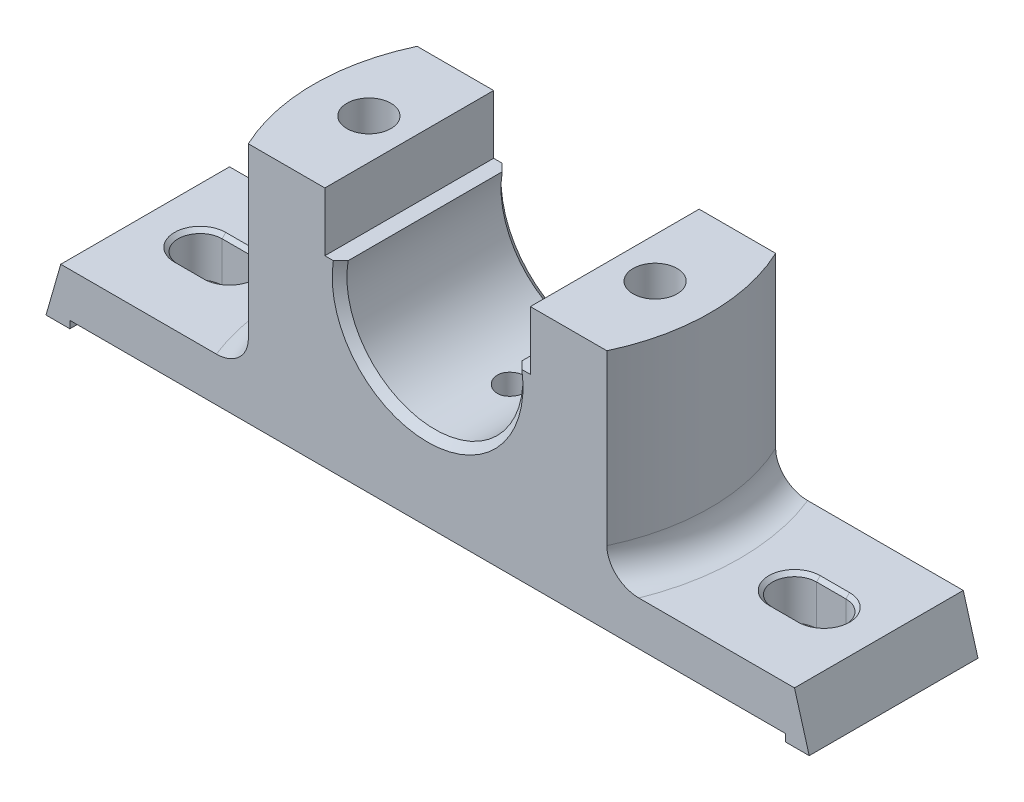
from build123d import *

# Parameters (mm, degrees)
BOSS_EXTRUDE1_DEPTH     = 23
CUT_EXTRUDE5_DEPTH      = 54
FILLET1_R               = 8
CHAMFER1_SIZE           = 2
CUT_EXTRUDE2_DEPTH      = 117.82893492196186
CUT_EXTRUDE2_DEPTH_BACK = 117.82893492196186
SKETCH4_W               = 195
SKETCH4_H               = 2
CUT_EXTRUDE6_DEPTH      = 120.41942905658195
SKETCH5_W               = 28.000000000000004
SKETCH5_H               = 30
SKETCH5_R               = 6.000000000000002
CUT_EXTRUDE3_DEPTH      = 10
SKETCH5_2_R             = 6.000000000000002
CUT_EXTRUDE7_DEPTH      = 126.30363138632497
CHAMFER2_SIZE           = 1
SKETCH9_R               = 4
CUT_EXTRUDE8_DEPTH      = 36


with BuildPart() as part:
    # Sketch1 → Boss-Extrude1 (new, symmetric)
    with BuildSketch(Plane.XY):
        with BuildLine():
            Line((-104, -48), (104, -48))
            Line((104, -48), (99.98556459937663, -34))
            Line((99.98556459937663, -34), (54.00000000000001, -34.00000000000001))
            Line((54.00000000000001, -34.00000000000001), (54.00000000000001, 20))
            Line((54.00000000000001, 20), (28.000000000000004, 20))
            Line((28.000000000000004, 20), (28, 4))
            Line((28, 4), (23.664319132398468, 4))
            ThreePointArc((23.664319132398468, 4), (1.47e-15, -24.000000000000004), (-23.664319132398465, 4))
            Line((-23.664319132398465, 4), (-28, 4))
            Line((-28, 4), (-28, 20))
            Line((-28, 20), (-54.00000000000001, 20))
            Line((-54.00000000000001, 20), (-54.00000000000001, -34.00000000000001))
            Line((-54.00000000000001, -34.00000000000001), (-99.98556459937662, -33.99999999999999))
            Line((-99.98556459937662, -33.99999999999999), (-104, -48))
        make_face()
    extrude(amount=BOSS_EXTRUDE1_DEPTH, both=True)

    # Sketch7 → Cut-Extrude5 (cut)
    with BuildSketch(Plane(origin=(0, 20, 0), x_dir=(1, 2.9e-16, 0), z_dir=(-2.9e-16, 1, 0))):
        with BuildLine():
            Line((-54.00000000000001, 23), (-54.00000000000001, 4.0501e-13))
            ThreePointArc((-54.000000000000014, 4.0856e-13), (-52.69855043578576, 11.784005344828431), (-48.856934001224445, 23))
            Line((-48.85693400122444, 23), (-54.00000000000001, 23))
        make_face()
        with BuildLine():
            Line((-54.00000000000001, 4.0501e-13), (-54.00000000000001, -23))
            Line((-54.00000000000001, -23), (-48.85693400122444, -23))
            ThreePointArc((-48.856934001224445, -23.000000000000004), (-52.69855043578586, -11.784005344828039), (-54.000000000000014, 4.0856e-13))
        make_face()
        with BuildLine():
            ThreePointArc((48.85693400122443, 23.000000000000004), (52.69855043578579, 11.784005344828252), (54, 3.286e-14))
            Line((54.00000000000001, 3.553e-14), (54.00000000000001, 23))
            Line((54.00000000000001, 23), (48.856934001224424, 23))
        make_face()
        with BuildLine():
            Line((48.856934001224424, -23), (54.00000000000001, -23))
            Line((54.00000000000001, -23), (54.00000000000001, 3.553e-14))
            ThreePointArc((54, 3.286e-14), (52.698550435785805, -11.784005344828213), (48.85693400122443, -23))
        make_face()
    extrude(amount=-CUT_EXTRUDE5_DEPTH, mode=Mode.SUBTRACT)

    # Fillet1
    fillet1_edges = [part.edges().sort_by_distance(p)[0] for p in [
        (-54.000000000000014, -34.000000000000014, -4.4e-16),
        (54.00000000000001, -33.999999999999986, 4.44e-15),
    ]]
    fillet(fillet1_edges, radius=FILLET1_R)

    # Chamfer1
    chamfer1_edges = [part.edges().sort_by_distance(p)[0] for p in [
        (-4.44e-15, -24.000000000000007, -23),
        (-4.44e-15, -24.000000000000007, 23),
    ]]
    chamfer(chamfer1_edges, length=CHAMFER1_SIZE)

    # Sketch4 → Cut-Extrude2 (cut, two sides: drawn at the far end of the back side and taken through both)
    with BuildSketch(Plane.XY.offset(-CUT_EXTRUDE2_DEPTH_BACK)):
        with Locations((0, -47)):
            Rectangle(SKETCH4_W, SKETCH4_H)
    extrude(amount=CUT_EXTRUDE2_DEPTH + CUT_EXTRUDE2_DEPTH_BACK, mode=Mode.SUBTRACT)

    # Sketch8 → Cut-Extrude6 (cut, through all)
    with BuildSketch(Plane(origin=(-1.026e-14, -34.00000000000002, 0), x_dir=(1, -3e-16, 0), z_dir=(3e-16, 1, 0))):
        with BuildLine():
            Line((-85, 6), (-77, 6))
            ThreePointArc((-77, 6), (-71, 0), (-77, -6))
            Line((-77, -6), (-85, -6))
            ThreePointArc((-85, -6), (-91, 7.3e-16), (-85, 6))
        make_face()
    cut_extrude6 = extrude(amount=-CUT_EXTRUDE6_DEPTH, mode=Mode.SUBTRACT)

    # Sketch5 → Cut-Extrude3 (cut)
    with BuildSketch(Plane.XZ.offset(46)):
        with Locations((-39.00000000000001, -1.78e-15)):
            Rectangle(SKETCH5_W, SKETCH5_H)
        with Locations(Location((-38.99999999999999, -3.47e-15, 0), (0, 0, 270))):
            Circle(SKETCH5_R, mode=Mode.SUBTRACT)
    cut_extrude3 = extrude(amount=-CUT_EXTRUDE3_DEPTH, mode=Mode.SUBTRACT)

    # Sketch5<2> → Cut-Extrude7 (cut, through all)
    with BuildSketch(Plane.XZ.offset(46)):
        with Locations(Location((-38.99999999999999, -3.47e-15, 0), (0, 0, 270))):
            Circle(SKETCH5_2_R)
    cut_extrude7 = extrude(amount=-CUT_EXTRUDE7_DEPTH, mode=Mode.SUBTRACT)

    # Mirror5: Cut-Extrude6, Cut-Extrude3, Cut-Extrude7 across plane
    add(cut_extrude6.mirror(Plane(origin=(0, 0, 0), x_dir=(0, 0, 1), z_dir=(1, 0, 0))), mode=Mode.SUBTRACT)
    add(cut_extrude3.mirror(Plane(origin=(0, 0, 0), x_dir=(0, 0, 1), z_dir=(1, 0, 0))), mode=Mode.SUBTRACT)
    add(cut_extrude7.mirror(Plane(origin=(0, 0, 0), x_dir=(0, 0, 1), z_dir=(1, 0, 0))), mode=Mode.SUBTRACT)

    # Chamfer2
    chamfer2_edges = [part.edges().sort_by_distance(p)[0] for p in [
        (-91.00000000000001, -33.99999999999999, 3.7e-16),
        (-81.00000000000001, -34, 6),
        (-71.00000000000001, -34, -3.7e-16),
        (-81.00000000000001, -34, -6),
        (91, -33.99999999999999, 3.7e-16),
        (81, -34, 6),
        (71, -34, -3.7e-16),
        (81, -34, -6),
    ]]
    chamfer(chamfer2_edges, length=CHAMFER2_SIZE)

    # Sketch9 → Cut-Extrude8 (cut)
    with BuildSketch(Plane(origin=(0, 0, 0), x_dir=(1, 0, 0), z_dir=(0, 1, 0))):
        with Locations(Location((0, 0, 0), (0, 0, 270))):
            Circle(SKETCH9_R)
    extrude(amount=-CUT_EXTRUDE8_DEPTH, mode=Mode.SUBTRACT)


solid = part.part
